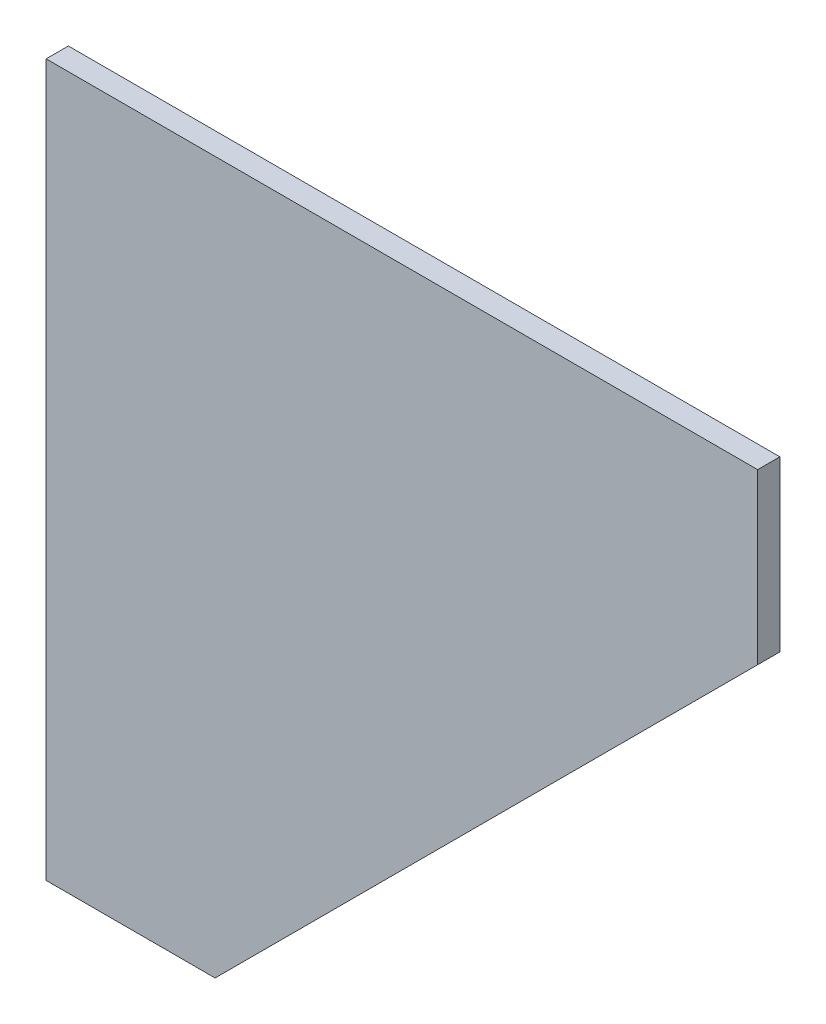
from build123d import *

# Parameters (mm, degrees)
BOSS_EXTRUDE1_DEPTH = 3.175


with BuildPart() as part:
    # Sketch1 → Boss-Extrude1 (new body)
    with BuildSketch(Plane.XY):
        Polygon((0, 0), (0, 101.6), (101.6, 101.6), (101.6, 77.47), (24.13, 0), align=None)
    extrude(amount=BOSS_EXTRUDE1_DEPTH)


solid = part.part
